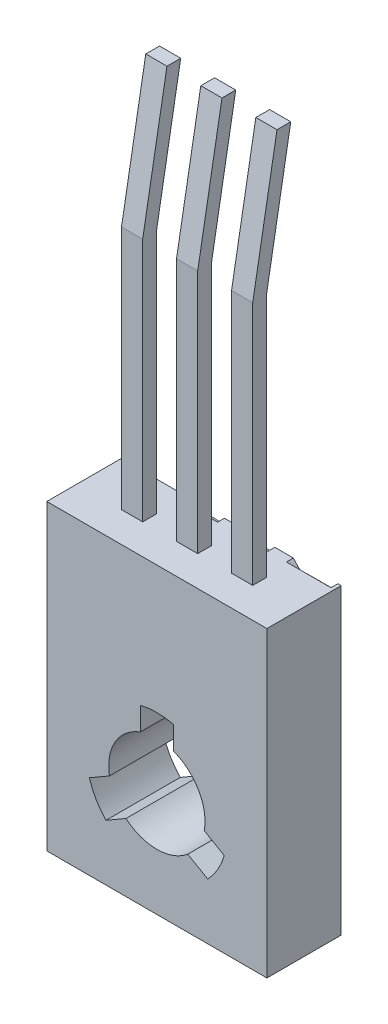
from build123d import *

# Parameters (mm, degrees)
SKETCH1_W           = 8
SKETCH1_H           = 11
SKETCH1_R           = 2.555
BOSS_EXTRUDE1_DEPTH = 1.35
SKETCH2_W           = 0.77
SKETCH2_H           = 0.5
BOSS_EXTRUDE2_DEPTH = 8.9
BOSS_EXTRUDE3_DEPTH = 2.7
CUT_EXTRUDE1_DEPTH  = 0.25
SKETCH8_W           = 0.77
SKETCH8_H           = 0.5


with BuildPart() as part:
    # Sketch1 → Boss-Extrude1 (new, symmetric)
    with BuildSketch(Plane.XY):
        Rectangle(SKETCH1_W, SKETCH1_H)
        with Locations(Location((0, -1.7, 0), (0, 0, 180))):
            Circle(SKETCH1_R, mode=Mode.SUBTRACT)
    extrude(amount=BOSS_EXTRUDE1_DEPTH, both=True)

    # Sketch2 → Boss-Extrude2 (add)
    with BuildSketch(Plane(origin=(0, 5.5, 0), x_dir=(1, 0, 0), z_dir=(0, 1, 0))):
        Rectangle(SKETCH2_W, SKETCH2_H)
        with Locations((-2, 0)):
            Rectangle(SKETCH2_W, SKETCH2_H)
        with Locations((2, 0)):
            Rectangle(SKETCH2_W, SKETCH2_H)
    extrude(amount=BOSS_EXTRUDE2_DEPTH)

    # Sketch4 → Boss-Extrude3 (add)
    with BuildSketch(Plane.XY.offset(1.35)):
        with BuildLine():
            Line((-0.6, 0.823242633), (-0.6, -0.056071778))
            ThreePointArc((-0.6, -0.056071778), (-1.515544457, -0.825), (-1.723683602, -2.002348869))
            Line((-1.723683602, -2.002348869), (-2.48519222, -2.442006074))
            ThreePointArc((-2.48519222, -2.442006074), (-2.246122223, -0.40320073), (-0.6, 0.823242633))
        make_face()
        with BuildLine():
            Line((0.6, 0.823242633), (0.6, -0.056071778))
            ThreePointArc((0.6, -0.056071778), (1.515544457, -0.825), (1.723683602, -2.002348869))
            Line((1.723683602, -2.002348869), (2.48519222, -2.442006074))
            ThreePointArc((2.48519222, -2.442006074), (2.246122223, -0.40320073), (0.6, 0.823242633))
        make_face()
        with BuildLine():
            Line((1.88519222, -3.481236559), (1.123683602, -3.041579353))
            ThreePointArc((1.123683602, -3.041579353), (0, -3.45), (-1.123683602, -3.041579353))
            Line((-1.123683602, -3.041579353), (-1.88519222, -3.481236559))
            ThreePointArc((-1.88519222, -3.481236559), (0, -4.29359854), (1.88519222, -3.481236559))
        make_face()
    extrude(amount=-BOSS_EXTRUDE3_DEPTH)

    # Sketch5 → Cut-Extrude1 (cut)
    # profile 1 of 4: a face of its own
    with BuildSketch(Plane(origin=(0, 0, -1.35), x_dir=(-1, 0, 0), z_dir=(0, 0, -1))):
        with BuildLine():
            Line((-2.565144231, 3.851442308), (-2.351442308, 3.851442308))
            add(Edge.make_bspline(
                [(-2.351442308, 3.851442308), (-2.352834866, 3.823091082), (-2.355569813, 3.767410029), (-2.368383128, 3.686229134), (-2.386700406, 3.60862398), (-2.412660261, 3.535259888), (-2.444718414, 3.465260463), (-2.48396687, 3.399555216), (-2.529568916, 3.337492029), (-2.581440894, 3.280245966), (-2.63772677, 3.227915907), (-2.698089305, 3.182248012), (-2.761908087, 3.14410457), (-2.828629577, 3.112044128), (-2.899025431, 3.088008093), (-2.972422742, 3.070165916), (-3.049153259, 3.059432938), (-3.101431858, 3.05827912), (-3.128019832, 3.057692308)],
                knots=[0, 0, 0, 0, 1.100776268, 2.161895295, 3.184016182, 4.190939212, 5.176500551, 6.166955529, 7.155448256, 8.160289653, 9.16017456, 10.133824356, 11.091467644, 12.04088621, 13.000931625, 13.972173743, 14.968683325, 16, 16, 16, 16], degree=3))
            add(Edge.make_bspline(
                [(-3.128019832, 3.057692308), (-3.154132466, 3.058298618), (-3.20544286, 3.059489997), (-3.280298343, 3.069875086), (-3.351728426, 3.085789309), (-3.418923594, 3.10937168), (-3.482573456, 3.138962397), (-3.541889923, 3.175762331), (-3.598307328, 3.218030232), (-3.649056804, 3.267887294), (-3.695676319, 3.321084906), (-3.735859523, 3.377899507), (-3.770465614, 3.436647555), (-3.798789619, 3.497787956), (-3.820260474, 3.561519813), (-3.83616832, 3.627232108), (-3.845262104, 3.695683204), (-3.846650102, 3.742021319), (-3.847355769, 3.765579928)],
                knots=[0, 0, 0, 0, 1.111674182, 2.184400057, 3.212814286, 4.223731311, 5.211378316, 6.196328225, 7.191884489, 8.207283132, 9.220262353, 10.201199469, 11.166417575, 12.120932471, 13.06540007, 14.026332106, 14.996573967, 16, 16, 16, 16], degree=3))
            add(Edge.make_bspline(
                [(-3.847355769, 3.765579928), (-3.846203728, 3.798745851), (-3.843919861, 3.864495682), (-3.824384095, 3.961116718), (-3.793871441, 4.054728587), (-3.757137209, 4.130072069), (-3.720069206, 4.190776967), (-3.686698963, 4.240783057), (-3.647411405, 4.294612004), (-3.602542189, 4.352481678), (-3.551318603, 4.413634228), (-3.495071429, 4.47931733), (-3.432348063, 4.548316458), (-3.388363905, 4.595474494), (-3.365572416, 4.619910607)],
                knots=[0, 0, 0, 0, 1.184416499, 2.348048165, 3.509039915, 4.696071444, 5.333504901, 6.05069495, 6.844171097, 7.714965912, 8.667477798, 9.695072654, 10.805644396, 12, 12, 12, 12], degree=3))
            Line((-3.365572416, 4.619910607), (-2.769782903, 5.255769231))
            Line((-2.769782903, 5.255769231), (-3.877884615, 5.255769231))
            Line((-3.877884615, 5.255769231), (-3.877884615, 5.5))
            Line((-3.877884615, 5.5), (-2.259855769, 5.5))
            Line((-2.259855769, 5.5), (-3.183353365, 4.514490685))
            add(Edge.make_bspline(
                [(-3.183353365, 4.514490685), (-3.205839323, 4.491020796), (-3.249030246, 4.445939942), (-3.31009352, 4.380103336), (-3.365026379, 4.319097523), (-3.413865261, 4.262652174), (-3.456650353, 4.211087279), (-3.49324476, 4.163998737), (-3.523810223, 4.121790649), (-3.556203245, 4.072206352), (-3.587092141, 4.011595014), (-3.61424032, 3.937897371), (-3.630675458, 3.861863655), (-3.632657075, 3.810497881), (-3.633653846, 3.784660457)],
                knots=[0, 0, 0, 0, 1.329530082, 2.553755191, 3.672934919, 4.687409497, 5.60679272, 6.413407421, 7.126401618, 7.737995624, 8.834647426, 9.90044882, 10.943907757, 12, 12, 12, 12], degree=3))
            add(Edge.make_bspline(
                [(-3.633653846, 3.784660457), (-3.633225757, 3.768410781), (-3.632382076, 3.736385791), (-3.624795144, 3.689462992), (-3.613648436, 3.644024979), (-3.596467914, 3.600633561), (-3.57582615, 3.558435313), (-3.549454774, 3.518713193), (-3.519319217, 3.480113169), (-3.484363448, 3.443958804), (-3.445988509, 3.410835792), (-3.405441819, 3.381496641), (-3.362545574, 3.356977011), (-3.317478542, 3.336876925), (-3.270366917, 3.321109377), (-3.221119432, 3.310183811), (-3.169872201, 3.30332412), (-3.134879055, 3.302395996), (-3.117048528, 3.301923077)],
                knots=[0, 0, 0, 0, 0.991504627, 1.954065223, 2.895985987, 3.842598665, 4.797835564, 5.759220273, 6.74786863, 7.784730864, 8.824135544, 9.839918996, 10.835834653, 11.835434876, 12.84861661, 13.863796685, 14.911511676, 16, 16, 16, 16], degree=3))
            add(Edge.make_bspline(
                [(-3.117048528, 3.301923077), (-3.098421829, 3.302390211), (-3.061842069, 3.303307585), (-3.008250293, 3.310260523), (-2.956767654, 3.320790393), (-2.908187486, 3.33755386), (-2.861493091, 3.357173308), (-2.817875667, 3.382577042), (-2.776109946, 3.411604737), (-2.737035641, 3.445449185), (-2.701447392, 3.48365447), (-2.669072444, 3.525240247), (-2.64164083, 3.570943748), (-2.617290062, 3.619668304), (-2.598666533, 3.672752581), (-2.582744749, 3.728898337), (-2.571179397, 3.78890664), (-2.567189365, 3.830250867), (-2.565144231, 3.851442308)],
                knots=[0, 0, 0, 0, 1.031072318, 2.024855787, 2.988461151, 3.935103592, 4.865765533, 5.788564469, 6.724086513, 7.67908574, 8.64457978, 9.611397706, 10.591395687, 11.591555111, 12.622101007, 13.700900657, 14.821571223, 16, 16, 16, 16], degree=3))
        make_face()
    # profile 2 of 4: a face of its own
    with BuildSketch(Plane(origin=(0, 0, -1.35), x_dir=(-1, 0, 0), z_dir=(0, 0, -1))):
        with BuildLine():
            add(Edge.make_bspline(
                [(-1.585836088, 4.173426232), (-1.605172184, 4.183587539), (-1.643001992, 4.203467473), (-1.696891986, 4.235574187), (-1.747189742, 4.268241646), (-1.792964971, 4.302644376), (-1.834666453, 4.338051095), (-1.872422521, 4.374368116), (-1.906639216, 4.41148058), (-1.936141046, 4.45034258), (-1.962316755, 4.490263035), (-1.984490792, 4.531733955), (-2.003843095, 4.574156078), (-2.019032241, 4.61817346), (-2.031572622, 4.663182243), (-2.040194669, 4.70978637), (-2.044833117, 4.75767258), (-2.045709901, 4.790036052), (-2.046153846, 4.806422776)],
                knots=[0, 0, 0, 0, 1.264219729, 2.473363326, 3.62979159, 4.734286947, 5.785533755, 6.79450939, 7.765315851, 8.704182021, 9.615576613, 10.525715488, 11.423813905, 12.311666436, 13.218214638, 14.126256791, 15.051260205, 16, 16, 16, 16], degree=3))
            add(Edge.make_bspline(
                [(-2.046153846, 4.806422776), (-2.045631946, 4.829350257), (-2.044598911, 4.874732345), (-2.035507403, 4.941696497), (-2.022078043, 5.006995638), (-2.001677559, 5.069889528), (-1.976573795, 5.130914034), (-1.944896164, 5.189246992), (-1.909143855, 5.246562873), (-1.880391485, 5.281816293), (-1.865842849, 5.299654447)],
                knots=[0, 0, 0, 0, 1.02531512, 2.029483338, 3.018748588, 4.004195107, 4.983200899, 5.966616707, 6.971112471, 8, 8, 8, 8], degree=3))
            add(Edge.make_bspline(
                [(-1.865842849, 5.299654447), (-1.846904104, 5.32046914), (-1.809260647, 5.361841313), (-1.744774406, 5.41555606), (-1.674002374, 5.460697344), (-1.597218401, 5.497485544), (-1.514627738, 5.526118959), (-1.426247981, 5.546694672), (-1.331906834, 5.55848011), (-1.267065076, 5.560183718), (-1.233800331, 5.561057692)],
                knots=[0, 0, 0, 0, 0.954267603, 1.896743057, 2.838368354, 3.796610408, 4.779680527, 5.799409237, 6.871065594, 8, 8, 8, 8], degree=3))
            add(Edge.make_bspline(
                [(-1.233800331, 5.561057692), (-1.201815172, 5.560271492), (-1.139575304, 5.558741625), (-1.048970249, 5.548432954), (-0.96440957, 5.530182666), (-0.885492346, 5.505719941), (-0.812981683, 5.473098316), (-0.746745741, 5.433113727), (-0.685813712, 5.386668894), (-0.63209711, 5.332646071), (-0.584420663, 5.274771146), (-0.542503712, 5.215081815), (-0.507859483, 5.153621521), (-0.477998941, 5.09132514), (-0.455776903, 5.026930414), (-0.440015566, 4.96109818), (-0.430115248, 4.894015461), (-0.42879113, 4.848751471), (-0.428125, 4.825980319)],
                knots=[0, 0, 0, 0, 1.256864279, 2.445730223, 3.576845088, 4.651810441, 5.686528262, 6.692706664, 7.686234615, 8.689148594, 9.678739427, 10.630299996, 11.55097961, 12.448208961, 13.341360817, 14.221834469, 15.105450545, 16, 16, 16, 16], degree=3))
            add(Edge.make_bspline(
                [(-0.428125, 4.825980319), (-0.428518262, 4.809271334), (-0.429295486, 4.776248484), (-0.434672214, 4.727459987), (-0.443323664, 4.679975703), (-0.455047176, 4.633608208), (-0.471081126, 4.588602158), (-0.49010311, 4.544725452), (-0.512496551, 4.501979361), (-0.53914324, 4.461014682), (-0.568500984, 4.420380349), (-0.603351327, 4.382094042), (-0.641370815, 4.343906877), (-0.684822763, 4.308141012), (-0.731360445, 4.271841685), (-0.783154269, 4.238042877), (-0.838477219, 4.204106755), (-0.877807424, 4.183828544), (-0.897983023, 4.173426232)],
                knots=[0, 0, 0, 0, 0.941575622, 1.860885767, 2.762557628, 3.660168386, 4.552890429, 5.45184204, 6.353736508, 7.268493418, 8.204037487, 9.175167802, 10.182660057, 11.238220596, 12.344046335, 13.507168087, 14.721227736, 16, 16, 16, 16], degree=3))
            add(Edge.make_bspline(
                [(-0.897983023, 4.173426232), (-0.870400013, 4.158322942), (-0.8170751, 4.129124475), (-0.745792597, 4.076147953), (-0.68541029, 4.01773148), (-0.63656988, 3.953787145), (-0.598007903, 3.886416575), (-0.570744146, 3.815974443), (-0.552948469, 3.743246411), (-0.55114575, 3.693653113), (-0.550240385, 3.668746244)],
                knots=[0, 0, 0, 0, 1.16701039, 2.256125286, 3.287752239, 4.277689688, 5.235169525, 6.160862735, 7.076343936, 8, 8, 8, 8], degree=3))
            add(Edge.make_bspline(
                [(-0.550240385, 3.668746244), (-0.551355031, 3.643371755), (-0.553595664, 3.592364606), (-0.571651427, 3.516414554), (-0.601298039, 3.441778548), (-0.640931145, 3.368629548), (-0.69136917, 3.300300664), (-0.751069622, 3.238521516), (-0.819957403, 3.184891014), (-0.896518382, 3.139555613), (-0.978761497, 3.102481252), (-1.065681667, 3.077171143), (-1.15572976, 3.060524663), (-1.217029532, 3.058645242), (-1.248110727, 3.057692308)],
                knots=[0, 0, 0, 0, 0.888724595, 1.786491426, 2.720083884, 3.697804067, 4.69440576, 5.687697823, 6.7000873, 7.744853364, 8.800284131, 9.853047784, 10.91141782, 12, 12, 12, 12], degree=3))
            add(Edge.make_bspline(
                [(-1.248110727, 3.057692308), (-1.278390346, 3.058672086), (-1.338098304, 3.060604097), (-1.425993938, 3.076876742), (-1.510165556, 3.10375002), (-1.590141408, 3.140351523), (-1.66421978, 3.185958066), (-1.730142675, 3.240178765), (-1.788448254, 3.301284757), (-1.836619187, 3.369839004), (-1.87526245, 3.442983127), (-1.903090051, 3.518857729), (-1.920682886, 3.596553192), (-1.922918412, 3.649098193), (-1.924038462, 3.675424429)],
                knots=[0, 0, 0, 0, 1.072634126, 2.115112298, 3.156050586, 4.19761425, 5.225177188, 6.230426315, 7.215180151, 8.209739481, 9.190420596, 10.139012357, 11.067603024, 12, 12, 12, 12], degree=3))
            add(Edge.make_bspline(
                [(-1.924038462, 3.675424429), (-1.923056544, 3.701259855), (-1.921128113, 3.751999164), (-1.905119462, 3.825858747), (-1.8777397, 3.894886533), (-1.840804315, 3.96014471), (-1.79232578, 4.020590457), (-1.733282922, 4.076523967), (-1.66444189, 4.129039184), (-1.612623717, 4.15829982), (-1.585836088, 4.173426232)],
                knots=[0, 0, 0, 0, 0.975463758, 1.915755378, 2.838359076, 3.772025586, 4.738400888, 5.753889765, 6.838863581, 8, 8, 8, 8], degree=3))
        make_face()
        with BuildLine():
            add(Edge.make_bspline(
                [(-1.236185397, 3.301923077), (-1.219481497, 3.302364854), (-1.186801365, 3.303229164), (-1.138892892, 3.307779512), (-1.093298345, 3.316520017), (-1.049768396, 3.328494392), (-1.008153928, 3.343392912), (-0.969409235, 3.363022221), (-0.932232274, 3.384840279), (-0.89784267, 3.410431869), (-0.866711346, 3.438352846), (-0.838905585, 3.467511909), (-0.816252521, 3.498768653), (-0.796763258, 3.530559346), (-0.782289759, 3.564202586), (-0.772008284, 3.598961743), (-0.764732004, 3.635056981), (-0.764207586, 3.659646622), (-0.763942308, 3.672085337)],
                knots=[0, 0, 0, 0, 1.20353747, 2.354645537, 3.462130888, 4.543058862, 5.604822423, 6.639552563, 7.666902586, 8.706944258, 9.720926464, 10.677177239, 11.602682187, 12.496457588, 13.358248655, 14.231532794, 15.105417644, 16, 16, 16, 16], degree=3))
            add(Edge.make_bspline(
                [(-0.763942308, 3.672085337), (-0.764426113, 3.684517008), (-0.765382181, 3.709083777), (-0.772302234, 3.745507441), (-0.783872622, 3.780834886), (-0.799738112, 3.815395902), (-0.820098498, 3.849101779), (-0.844809926, 3.882081675), (-0.874944619, 3.913463463), (-0.908222414, 3.944137505), (-0.944572517, 3.972397954), (-0.982769862, 3.997641733), (-1.023093217, 4.017765852), (-1.06433499, 4.035410592), (-1.107367349, 4.048646192), (-1.15189358, 4.058181663), (-1.197866122, 4.064079946), (-1.229012739, 4.064786662), (-1.244771635, 4.065144231)],
                knots=[0, 0, 0, 0, 0.873213166, 1.72559466, 2.594724523, 3.479581045, 4.391597569, 5.35687048, 6.368548091, 7.443976143, 8.534559525, 9.600545123, 10.654815915, 11.696401765, 12.749428718, 13.812189468, 14.893058657, 16, 16, 16, 16], degree=3))
            add(Edge.make_bspline(
                [(-1.244771635, 4.065144231), (-1.265013542, 4.064553364), (-1.305297429, 4.063377467), (-1.364660625, 4.052344616), (-1.422526027, 4.035209555), (-1.477798721, 4.010889433), (-1.529489457, 3.981237361), (-1.576140343, 3.94626927), (-1.615799126, 3.90516396), (-1.649538657, 3.860305852), (-1.675918194, 3.812722236), (-1.696125332, 3.764775474), (-1.708025553, 3.716070631), (-1.709572484, 3.683434642), (-1.710336538, 3.667315204)],
                knots=[0, 0, 0, 0, 1.076561449, 2.142489767, 3.202892658, 4.283174188, 5.348766409, 6.369549039, 7.375093932, 8.378927502, 9.349008457, 10.26378795, 11.142457041, 12, 12, 12, 12], degree=3))
            add(Edge.make_bspline(
                [(-1.710336538, 3.667315204), (-1.709981352, 3.655999829), (-1.709276356, 3.63354043), (-1.703231445, 3.600265354), (-1.69380323, 3.567726527), (-1.680060274, 3.53611497), (-1.663435576, 3.504696317), (-1.642244485, 3.4744562), (-1.61768522, 3.444479468), (-1.589403232, 3.415752822), (-1.557450419, 3.388783475), (-1.521568308, 3.365405276), (-1.482073546, 3.345910458), (-1.439495622, 3.329532403), (-1.39338458, 3.317368284), (-1.344137425, 3.308214342), (-1.291309797, 3.303065474), (-1.254958723, 3.302312135), (-1.236185397, 3.301923077)],
                knots=[0, 0, 0, 0, 0.814035228, 1.61574325, 2.427118093, 3.24780647, 4.092880925, 4.981933388, 5.900917883, 6.880367106, 7.87994501, 8.905470125, 9.95492938, 11.0455354, 12.184050453, 13.382997595, 14.64846247, 16, 16, 16, 16], degree=3))
        make_face(mode=Mode.SUBTRACT)
        with BuildLine():
            add(Edge.make_bspline(
                [(-1.25001878, 4.309375), (-1.228842188, 4.309751781), (-1.18729888, 4.310490935), (-1.126435398, 4.31871459), (-1.068027577, 4.330170132), (-1.012254718, 4.347520158), (-0.959403111, 4.370094899), (-0.908728966, 4.396864676), (-0.861025827, 4.428950898), (-0.81650691, 4.46557551), (-0.775748647, 4.505264722), (-0.739860426, 4.547181831), (-0.709539968, 4.590757656), (-0.684934576, 4.636047312), (-0.665846364, 4.682951014), (-0.651758969, 4.731496133), (-0.643579846, 4.781818079), (-0.642414489, 4.815934329), (-0.641826923, 4.833135517)],
                knots=[0, 0, 0, 0, 1.140332253, 2.237053636, 3.304055028, 4.344690294, 5.377465719, 6.397042765, 7.428360044, 8.469453732, 9.499453352, 10.490108612, 11.438398528, 12.354680514, 13.261581007, 14.161901135, 15.073242693, 16, 16, 16, 16], degree=3))
            add(Edge.make_bspline(
                [(-0.641826923, 4.833135517), (-0.642771565, 4.854516022), (-0.644652574, 4.897089713), (-0.659040073, 4.959850893), (-0.682668507, 5.020592568), (-0.715816413, 5.078458073), (-0.756249108, 5.132745813), (-0.805402936, 5.180732742), (-0.862079475, 5.221772883), (-0.925813099, 5.256074021), (-0.99567763, 5.283240988), (-1.071241319, 5.302677098), (-1.151992321, 5.314893515), (-1.207678773, 5.316172298), (-1.236185397, 5.316826923)],
                knots=[0, 0, 0, 0, 0.899105568, 1.790333855, 2.694925079, 3.632758987, 4.588257081, 5.534574046, 6.511571685, 7.523527334, 8.572244311, 9.657983075, 10.801090915, 12, 12, 12, 12], degree=3))
            add(Edge.make_bspline(
                [(-1.236185397, 5.316826923), (-1.258465799, 5.316394113), (-1.301875167, 5.315550859), (-1.365228248, 5.308262465), (-1.424873604, 5.296357044), (-1.481382653, 5.28021457), (-1.534334788, 5.258816306), (-1.583657833, 5.23223761), (-1.630023433, 5.201878996), (-1.671450011, 5.165937021), (-1.709116956, 5.127476885), (-1.74211023, 5.086977091), (-1.770032686, 5.044843246), (-1.792540868, 5.001100015), (-1.810414515, 4.95590815), (-1.823299379, 4.909082139), (-1.831240684, 4.860438054), (-1.832044482, 4.827441609), (-1.832451923, 4.810715895)],
                knots=[0, 0, 0, 0, 1.224631902, 2.385975653, 3.500340538, 4.565441647, 5.612488581, 6.63322211, 7.641830068, 8.652595074, 9.641693811, 10.598750962, 11.520088299, 12.415429315, 13.298523938, 14.187139574, 15.081071174, 16, 16, 16, 16], degree=3))
            add(Edge.make_bspline(
                [(-1.832451923, 4.810715895), (-1.831839694, 4.794468926), (-1.830632486, 4.762432742), (-1.822860434, 4.714993415), (-1.809518391, 4.668973249), (-1.790063442, 4.624579806), (-1.766171777, 4.581296675), (-1.736657948, 4.539487225), (-1.701881667, 4.499035686), (-1.661928058, 4.460774912), (-1.618627368, 4.425404563), (-1.572738091, 4.393971705), (-1.524051095, 4.368281343), (-1.47353085, 4.346699629), (-1.420668067, 4.329880862), (-1.365717721, 4.318087321), (-1.308575711, 4.310675089), (-1.269758274, 4.309813259), (-1.25001878, 4.309375)],
                knots=[0, 0, 0, 0, 0.917336384, 1.808827106, 2.706624561, 3.615530867, 4.539869921, 5.493819324, 6.499753197, 7.547410123, 8.613069608, 9.653934021, 10.682176708, 11.716048074, 12.752411263, 13.808993382, 14.885826486, 16, 16, 16, 16], degree=3))
        make_face(mode=Mode.SUBTRACT)
    # profile 3 of 4: a face of its own
    with BuildSketch(Plane(origin=(0, 0, -1.35), x_dir=(-1, 0, 0), z_dir=(0, 0, -1))):
        with BuildLine():
            add(Edge.make_bspline(
                [(0.245894681, 4.173426232), (0.226558586, 4.183587539), (0.188728777, 4.203467473), (0.134838783, 4.235574187), (0.084541027, 4.268241646), (0.038765798, 4.302644376), (-0.002935684, 4.338051095), (-0.040691752, 4.374368116), (-0.074908447, 4.41148058), (-0.104410276, 4.45034258), (-0.130585986, 4.490263035), (-0.152760023, 4.531733955), (-0.172112325, 4.574156078), (-0.187301472, 4.61817346), (-0.199841853, 4.663182243), (-0.208463899, 4.70978637), (-0.213102348, 4.75767258), (-0.213979132, 4.790036052), (-0.214423077, 4.806422776)],
                knots=[0, 0, 0, 0, 1.264219729, 2.473363326, 3.62979159, 4.734286947, 5.785533755, 6.79450939, 7.765315851, 8.704182021, 9.615576613, 10.525715488, 11.423813905, 12.311666436, 13.218214638, 14.126256791, 15.051260205, 16, 16, 16, 16], degree=3))
            add(Edge.make_bspline(
                [(-0.214423077, 4.806422776), (-0.213901177, 4.829350257), (-0.212868142, 4.874732345), (-0.203776634, 4.941696497), (-0.190347274, 5.006995638), (-0.16994679, 5.069889528), (-0.144843026, 5.130914034), (-0.113165395, 5.189246992), (-0.077413086, 5.246562873), (-0.048660716, 5.281816293), (-0.034112079, 5.299654447)],
                knots=[0, 0, 0, 0, 1.02531512, 2.029483338, 3.018748588, 4.004195107, 4.983200899, 5.966616707, 6.971112471, 8, 8, 8, 8], degree=3))
            add(Edge.make_bspline(
                [(-0.034112079, 5.299654447), (-0.015173335, 5.32046914), (0.022470122, 5.361841313), (0.086956364, 5.41555606), (0.157728395, 5.460697344), (0.234512368, 5.497485544), (0.317103032, 5.526118959), (0.405482788, 5.546694672), (0.499823935, 5.55848011), (0.564665693, 5.560183718), (0.597930439, 5.561057692)],
                knots=[0, 0, 0, 0, 0.954267603, 1.896743057, 2.838368354, 3.796610408, 4.779680527, 5.799409237, 6.871065594, 8, 8, 8, 8], degree=3))
            add(Edge.make_bspline(
                [(0.597930439, 5.561057692), (0.629915597, 5.560271492), (0.692155466, 5.558741625), (0.78276052, 5.548432954), (0.867321199, 5.530182666), (0.946238423, 5.505719941), (1.018749086, 5.473098316), (1.084985028, 5.433113727), (1.145917057, 5.386668894), (1.199633659, 5.332646071), (1.247310106, 5.274771146), (1.289227057, 5.215081815), (1.323871286, 5.153621521), (1.353731828, 5.09132514), (1.375953866, 5.026930414), (1.391715203, 4.96109818), (1.401615521, 4.894015461), (1.402939639, 4.848751471), (1.403605769, 4.825980319)],
                knots=[0, 0, 0, 0, 1.256864279, 2.445730223, 3.576845088, 4.651810441, 5.686528262, 6.692706664, 7.686234615, 8.689148594, 9.678739427, 10.630299996, 11.55097961, 12.448208961, 13.341360817, 14.221834469, 15.105450545, 16, 16, 16, 16], degree=3))
            add(Edge.make_bspline(
                [(1.403605769, 4.825980319), (1.403212507, 4.809271334), (1.402435283, 4.776248484), (1.397058556, 4.727459987), (1.388407105, 4.679975703), (1.376683593, 4.633608208), (1.360649643, 4.588602158), (1.341627659, 4.544725452), (1.319234219, 4.501979361), (1.292587529, 4.461014682), (1.263229785, 4.420380349), (1.228379443, 4.382094042), (1.190359954, 4.343906877), (1.146908006, 4.308141012), (1.100370324, 4.271841685), (1.0485765, 4.238042877), (0.99325355, 4.204106755), (0.953923345, 4.183828544), (0.933747746, 4.173426232)],
                knots=[0, 0, 0, 0, 0.941575622, 1.860885767, 2.762557628, 3.660168386, 4.552890429, 5.45184204, 6.353736508, 7.268493418, 8.204037487, 9.175167802, 10.182660057, 11.238220596, 12.344046335, 13.507168087, 14.721227736, 16, 16, 16, 16], degree=3))
            add(Edge.make_bspline(
                [(0.933747746, 4.173426232), (0.961330757, 4.158322942), (1.014655669, 4.129124475), (1.085938172, 4.076147953), (1.14632048, 4.01773148), (1.195160889, 3.953787145), (1.233722866, 3.886416575), (1.260986623, 3.815974443), (1.2787823, 3.743246411), (1.280585019, 3.693653113), (1.281490385, 3.668746244)],
                knots=[0, 0, 0, 0, 1.16701039, 2.256125286, 3.287752239, 4.277689688, 5.235169525, 6.160862735, 7.076343936, 8, 8, 8, 8], degree=3))
            add(Edge.make_bspline(
                [(1.281490385, 3.668746244), (1.280375738, 3.643371755), (1.278135105, 3.592364606), (1.260079342, 3.516414554), (1.230432731, 3.441778548), (1.190799625, 3.368629548), (1.140361599, 3.300300664), (1.080661147, 3.238521516), (1.011773366, 3.184891014), (0.935212387, 3.139555613), (0.852969272, 3.102481252), (0.766049103, 3.077171143), (0.67600101, 3.060524663), (0.614701237, 3.058645242), (0.583620042, 3.057692308)],
                knots=[0, 0, 0, 0, 0.888724595, 1.786491426, 2.720083884, 3.697804067, 4.69440576, 5.687697823, 6.7000873, 7.744853364, 8.800284131, 9.853047784, 10.91141782, 12, 12, 12, 12], degree=3))
            add(Edge.make_bspline(
                [(0.583620042, 3.057692308), (0.553340424, 3.058672086), (0.493632466, 3.060604097), (0.405736831, 3.076876742), (0.321565214, 3.10375002), (0.241589362, 3.140351523), (0.167510989, 3.185958066), (0.101588095, 3.240178765), (0.043282515, 3.301284757), (-0.004888418, 3.369839004), (-0.043531681, 3.442983127), (-0.071359281, 3.518857729), (-0.088952117, 3.596553192), (-0.091187643, 3.649098193), (-0.092307692, 3.675424429)],
                knots=[0, 0, 0, 0, 1.072634126, 2.115112298, 3.156050586, 4.19761425, 5.225177188, 6.230426315, 7.215180151, 8.209739481, 9.190420596, 10.139012357, 11.067603024, 12, 12, 12, 12], degree=3))
            add(Edge.make_bspline(
                [(-0.092307692, 3.675424429), (-0.091325774, 3.701259855), (-0.089397343, 3.751999164), (-0.073388693, 3.825858747), (-0.046008931, 3.894886533), (-0.009073546, 3.96014471), (0.03940499, 4.020590457), (0.098447848, 4.076523967), (0.167288879, 4.129039184), (0.219107052, 4.15829982), (0.245894681, 4.173426232)],
                knots=[0, 0, 0, 0, 0.975463758, 1.915755378, 2.838359076, 3.772025586, 4.738400888, 5.753889765, 6.838863581, 8, 8, 8, 8], degree=3))
        make_face()
        with BuildLine():
            add(Edge.make_bspline(
                [(0.595545373, 3.301923077), (0.612249272, 3.302364854), (0.644929404, 3.303229164), (0.692837878, 3.307779512), (0.738432424, 3.316520017), (0.781962373, 3.328494392), (0.823576841, 3.343392912), (0.862321534, 3.363022221), (0.899498495, 3.384840279), (0.9338881, 3.410431869), (0.965019423, 3.438352846), (0.992825184, 3.467511909), (1.015478249, 3.498768653), (1.034967511, 3.530559346), (1.049441011, 3.564202586), (1.059722486, 3.598961743), (1.066998765, 3.635056981), (1.067523184, 3.659646622), (1.067788462, 3.672085337)],
                knots=[0, 0, 0, 0, 1.20353747, 2.354645537, 3.462130888, 4.543058862, 5.604822423, 6.639552563, 7.666902586, 8.706944258, 9.720926464, 10.677177239, 11.602682187, 12.496457588, 13.358248655, 14.231532794, 15.105417644, 16, 16, 16, 16], degree=3))
            add(Edge.make_bspline(
                [(1.067788462, 3.672085337), (1.067304657, 3.684517008), (1.066348588, 3.709083777), (1.059428535, 3.745507441), (1.047858147, 3.780834886), (1.031992657, 3.815395902), (1.011632271, 3.849101779), (0.986920843, 3.882081675), (0.95678615, 3.913463463), (0.923508355, 3.944137505), (0.887158252, 3.972397954), (0.848960907, 3.997641733), (0.808637552, 4.017765852), (0.767395779, 4.035410592), (0.72436342, 4.048646192), (0.679837189, 4.058181663), (0.633864647, 4.064079946), (0.60271803, 4.064786662), (0.586959135, 4.065144231)],
                knots=[0, 0, 0, 0, 0.873213166, 1.72559466, 2.594724523, 3.479581045, 4.391597569, 5.35687048, 6.368548091, 7.443976143, 8.534559525, 9.600545123, 10.654815915, 11.696401765, 12.749428718, 13.812189468, 14.893058657, 16, 16, 16, 16], degree=3))
            add(Edge.make_bspline(
                [(0.586959135, 4.065144231), (0.566717227, 4.064553364), (0.52643334, 4.063377467), (0.467070144, 4.052344616), (0.409204742, 4.035209555), (0.353932048, 4.010889433), (0.302241312, 3.981237361), (0.255590426, 3.94626927), (0.215931644, 3.90516396), (0.182192112, 3.860305852), (0.155812575, 3.812722236), (0.135605437, 3.764775474), (0.123705216, 3.716070631), (0.122158285, 3.683434642), (0.121394231, 3.667315204)],
                knots=[0, 0, 0, 0, 1.076561449, 2.142489767, 3.202892658, 4.283174188, 5.348766409, 6.369549039, 7.375093932, 8.378927502, 9.349008457, 10.26378795, 11.142457041, 12, 12, 12, 12], degree=3))
            add(Edge.make_bspline(
                [(0.121394231, 3.667315204), (0.121749418, 3.655999829), (0.122454413, 3.63354043), (0.128499324, 3.600265354), (0.137927539, 3.567726527), (0.151670495, 3.53611497), (0.168295194, 3.504696317), (0.189486284, 3.4744562), (0.214045549, 3.444479468), (0.242327537, 3.415752822), (0.27428035, 3.388783475), (0.310162461, 3.365405276), (0.349657223, 3.345910458), (0.392235147, 3.329532403), (0.438346189, 3.317368284), (0.487593344, 3.308214342), (0.540420972, 3.303065474), (0.576772046, 3.302312135), (0.595545373, 3.301923077)],
                knots=[0, 0, 0, 0, 0.814035228, 1.61574325, 2.427118093, 3.24780647, 4.092880925, 4.981933388, 5.900917883, 6.880367106, 7.87994501, 8.905470125, 9.95492938, 11.0455354, 12.184050453, 13.382997595, 14.64846247, 16, 16, 16, 16], degree=3))
        make_face(mode=Mode.SUBTRACT)
        with BuildLine():
            add(Edge.make_bspline(
                [(0.581711989, 4.309375), (0.602888582, 4.309751781), (0.644431889, 4.310490935), (0.705295371, 4.31871459), (0.763703192, 4.330170132), (0.819476052, 4.347520158), (0.872327658, 4.370094899), (0.923001803, 4.396864676), (0.970704942, 4.428950898), (1.015223859, 4.46557551), (1.055982123, 4.505264722), (1.091870343, 4.547181831), (1.122190801, 4.590757656), (1.146796193, 4.636047312), (1.165884405, 4.682951014), (1.1799718, 4.731496133), (1.188150923, 4.781818079), (1.18931628, 4.815934329), (1.189903846, 4.833135517)],
                knots=[0, 0, 0, 0, 1.140332253, 2.237053636, 3.304055028, 4.344690294, 5.377465719, 6.397042765, 7.428360044, 8.469453732, 9.499453352, 10.490108612, 11.438398528, 12.354680514, 13.261581007, 14.161901135, 15.073242693, 16, 16, 16, 16], degree=3))
            add(Edge.make_bspline(
                [(1.189903846, 4.833135517), (1.188959204, 4.854516022), (1.187078195, 4.897089713), (1.172690696, 4.959850893), (1.149062263, 5.020592568), (1.115914356, 5.078458073), (1.075481661, 5.132745813), (1.026327833, 5.180732742), (0.969651294, 5.221772883), (0.90591767, 5.256074021), (0.836053139, 5.283240988), (0.760489451, 5.302677098), (0.679738449, 5.314893515), (0.624051996, 5.316172298), (0.595545373, 5.316826923)],
                knots=[0, 0, 0, 0, 0.899105568, 1.790333855, 2.694925079, 3.632758987, 4.588257081, 5.534574046, 6.511571685, 7.523527334, 8.572244311, 9.657983075, 10.801090915, 12, 12, 12, 12], degree=3))
            add(Edge.make_bspline(
                [(0.595545373, 5.316826923), (0.573264971, 5.316394113), (0.529855603, 5.315550859), (0.466502521, 5.308262465), (0.406857166, 5.296357044), (0.350348116, 5.28021457), (0.297395981, 5.258816306), (0.248072936, 5.23223761), (0.201707336, 5.201878996), (0.160280758, 5.165937021), (0.122613814, 5.127476885), (0.089620539, 5.086977091), (0.061698083, 5.044843246), (0.039189901, 5.001100015), (0.021316254, 4.95590815), (0.00843139, 4.909082139), (0.000490085, 4.860438054), (-0.000313713, 4.827441609), (-0.000721154, 4.810715895)],
                knots=[0, 0, 0, 0, 1.224631902, 2.385975653, 3.500340538, 4.565441647, 5.612488581, 6.63322211, 7.641830068, 8.652595074, 9.641693811, 10.598750962, 11.520088299, 12.415429315, 13.298523938, 14.187139574, 15.081071174, 16, 16, 16, 16], degree=3))
            add(Edge.make_bspline(
                [(-0.000721154, 4.810715895), (-0.000108925, 4.794468926), (0.001098283, 4.762432742), (0.008870335, 4.714993415), (0.022212378, 4.668973249), (0.041667327, 4.624579806), (0.065558992, 4.581296675), (0.095072822, 4.539487225), (0.129849102, 4.499035686), (0.169802711, 4.460774912), (0.213103401, 4.425404563), (0.258992678, 4.393971705), (0.307679674, 4.368281343), (0.35819992, 4.346699629), (0.411062703, 4.329880862), (0.466013049, 4.318087321), (0.523155058, 4.310675089), (0.561972496, 4.309813259), (0.581711989, 4.309375)],
                knots=[0, 0, 0, 0, 0.917336384, 1.808827106, 2.706624561, 3.615530867, 4.539869921, 5.493819324, 6.499753197, 7.547410123, 8.613069608, 9.653934021, 10.682176708, 11.716048074, 12.752411263, 13.808993382, 14.885826486, 16, 16, 16, 16], degree=3))
        make_face(mode=Mode.SUBTRACT)
    # profile 4 of 4: a face of its own
    with BuildSketch(Plane(origin=(0, 0, -1.35), x_dir=(-1, 0, 0), z_dir=(0, 0, -1))):
        with BuildLine():
            Line((3.632211538, 5.5), (3.632211538, 3.11875))
            Line((3.632211538, 3.11875), (3.151382212, 3.11875))
            add(Edge.make_bspline(
                [(3.151382212, 3.11875), (3.109561259, 3.119050285), (3.028763398, 3.119630435), (2.912006808, 3.123329907), (2.804131222, 3.1298082), (2.705197901, 3.139426621), (2.615047901, 3.150971422), (2.533825607, 3.165653527), (2.461399393, 3.182920676), (2.416856879, 3.197648006), (2.395793269, 3.20461238)],
                knots=[0, 0, 0, 0, 1.314317071, 2.539253741, 3.67075822, 4.709970291, 5.662644612, 6.526156501, 7.303037452, 8, 8, 8, 8], degree=3))
            add(Edge.make_bspline(
                [(2.395793269, 3.20461238), (2.36823992, 3.215107513), (2.313758041, 3.235859785), (2.236228248, 3.275065916), (2.162995079, 3.319306538), (2.094636788, 3.369595937), (2.031002749, 3.425291472), (1.971292309, 3.485942522), (1.917216957, 3.553168265), (1.866911617, 3.624882712), (1.822881392, 3.701738479), (1.784055195, 3.782196155), (1.750903518, 3.866099629), (1.725036305, 3.954061105), (1.703665516, 4.045235749), (1.689326242, 4.140313863), (1.679801238, 4.238741136), (1.678848698, 4.305535693), (1.678365385, 4.339426833)],
                knots=[0, 0, 0, 0, 0.984696416, 1.947063185, 2.89840987, 3.841051395, 4.778753227, 5.721858861, 6.681155121, 7.65838316, 8.646299769, 9.637283673, 10.641736726, 11.657050558, 12.698485921, 13.768600492, 14.86780186, 16, 16, 16, 16], degree=3))
            add(Edge.make_bspline(
                [(1.678365385, 4.339426833), (1.678793596, 4.368859826), (1.679637431, 4.426860612), (1.687205208, 4.512342722), (1.698225983, 4.59528227), (1.71521022, 4.67531508), (1.736080056, 4.752979988), (1.761838755, 4.827909262), (1.792369353, 4.90015383), (1.827776176, 4.969139873), (1.866545203, 5.034699642), (1.908790422, 5.095794384), (1.953065384, 5.153097695), (2.000984876, 5.205315031), (2.050962335, 5.254072454), (2.104697561, 5.29720708), (2.160508042, 5.336721427), (2.220070486, 5.37141551), (2.283873582, 5.402276929), (2.353583956, 5.428339581), (2.428947185, 5.450768436), (2.510462641, 5.468638212), (2.597858463, 5.483042158), (2.691371561, 5.492634447), (2.790826825, 5.499139216), (2.859120799, 5.499707501), (2.894272085, 5.5)],
                knots=[0, 0, 0, 0, 1.105894396, 2.179280415, 3.222964075, 4.248423888, 5.251546139, 6.243661943, 7.223682738, 8.196462441, 9.155694589, 10.083899862, 10.986397372, 11.874737962, 12.745335529, 13.607670254, 14.461432187, 15.313100333, 16.195087267, 17.121790994, 18.106827133, 19.14775296, 20.255889161, 21.433815148, 22.679170477, 24, 24, 24, 24], degree=3))
            Line((2.894272085, 5.5), (3.632211538, 5.5))
        make_face()
        with BuildLine():
            Line((3.418509615, 5.255769231), (3.14518104, 5.255769231))
            add(Edge.make_bspline(
                [(3.14518104, 5.255769231), (3.10590513, 5.255600437), (3.030363173, 5.255275784), (2.921738714, 5.25242699), (2.822488625, 5.247772029), (2.732598812, 5.241257556), (2.652120029, 5.232638374), (2.580884085, 5.223028395), (2.51912449, 5.211055844), (2.481752855, 5.200203495), (2.464483173, 5.195188552)],
                knots=[0, 0, 0, 0, 1.375205317, 2.645023457, 3.804390687, 4.853969522, 5.800190428, 6.637939096, 7.370582563, 8, 8, 8, 8], degree=3))
            add(Edge.make_bspline(
                [(2.464483173, 5.195188552), (2.442746415, 5.187534046), (2.39979208, 5.172407861), (2.337967164, 5.144805896), (2.280277489, 5.112150644), (2.225761309, 5.07563751), (2.174768982, 5.034702696), (2.127536649, 4.98921602), (2.083691232, 4.939704092), (2.04393474, 4.886000078), (2.007978146, 4.828699853), (1.976911768, 4.767867243), (1.950723162, 4.703843619), (1.929237153, 4.636851731), (1.912485433, 4.566851707), (1.900691563, 4.493667883), (1.89338304, 4.417329158), (1.892510667, 4.36536113), (1.892067308, 4.33894982)],
                knots=[0, 0, 0, 0, 0.998420628, 1.972994, 2.929372424, 3.86770908, 4.81360496, 5.759023883, 6.706048443, 7.676227424, 8.651287839, 9.634325482, 10.632389399, 11.645655052, 12.680158286, 13.74837235, 14.855672678, 16, 16, 16, 16], degree=3))
            add(Edge.make_bspline(
                [(1.892067308, 4.33894982), (1.892416899, 4.311100601), (1.893103673, 4.256390564), (1.901721454, 4.176112387), (1.914341846, 4.098913581), (1.932495294, 4.024738566), (1.955947985, 3.953683844), (1.98401103, 3.885347987), (2.018083972, 3.820610412), (2.056658144, 3.758922817), (2.099964717, 3.701219422), (2.147811585, 3.648176252), (2.199694231, 3.599694501), (2.255373544, 3.555696978), (2.315628015, 3.516966118), (2.379438021, 3.482511749), (2.447702409, 3.453237269), (2.495200869, 3.437672613), (2.519339694, 3.42976262)],
                knots=[0, 0, 0, 0, 1.122272916, 2.204715076, 3.251197285, 4.274229216, 5.279697671, 6.265416158, 7.248880903, 8.225321784, 9.195852973, 10.153576302, 11.101466393, 12.055578741, 13.010401466, 13.985536859, 14.976245305, 16, 16, 16, 16], degree=3))
            add(Edge.make_bspline(
                [(2.519339694, 3.42976262), (2.539308956, 3.424240551), (2.581769086, 3.412499115), (2.651056293, 3.399691139), (2.729035528, 3.388394149), (2.816053003, 3.378829662), (2.912009526, 3.371966681), (3.016978896, 3.366815483), (3.131006484, 3.363341149), (3.210052101, 3.363103903), (3.251077975, 3.362980769)],
                knots=[0, 0, 0, 0, 0.674548936, 1.434276114, 2.292660221, 3.240891867, 4.284742987, 5.42552168, 6.663806718, 8, 8, 8, 8], degree=3))
            Line((3.251077975, 3.362980769), (3.418509615, 3.362980769))
            Line((3.418509615, 3.362980769), (3.418509615, 5.255769231))
        make_face(mode=Mode.SUBTRACT)
    extrude(amount=-CUT_EXTRUDE1_DEPTH, mode=Mode.SUBTRACT)

    # Sweep1: sweep along a path in Sketch7
    with BuildLine(Plane(origin=(0, 0, 0), x_dir=(0, 0, -1), z_dir=(1, 0, 0))) as sweep1_path:
        Line((0, 14.4), (0.882132743, 19.402823385))
    # Sketch8 → Sweep1 (sweep)
    with BuildSketch(Plane(origin=(0, 14.4, 0), x_dir=(1, 0, 0), z_dir=(0, 1, 0))):
        with Locations((2, 0)):
            Rectangle(SKETCH8_W, SKETCH8_H)
        Rectangle(SKETCH8_W, SKETCH8_H)
        with Locations((-2, 0)):
            Rectangle(SKETCH8_W, SKETCH8_H)
    sweep(path=sweep1_path.line)


solid = part.part
